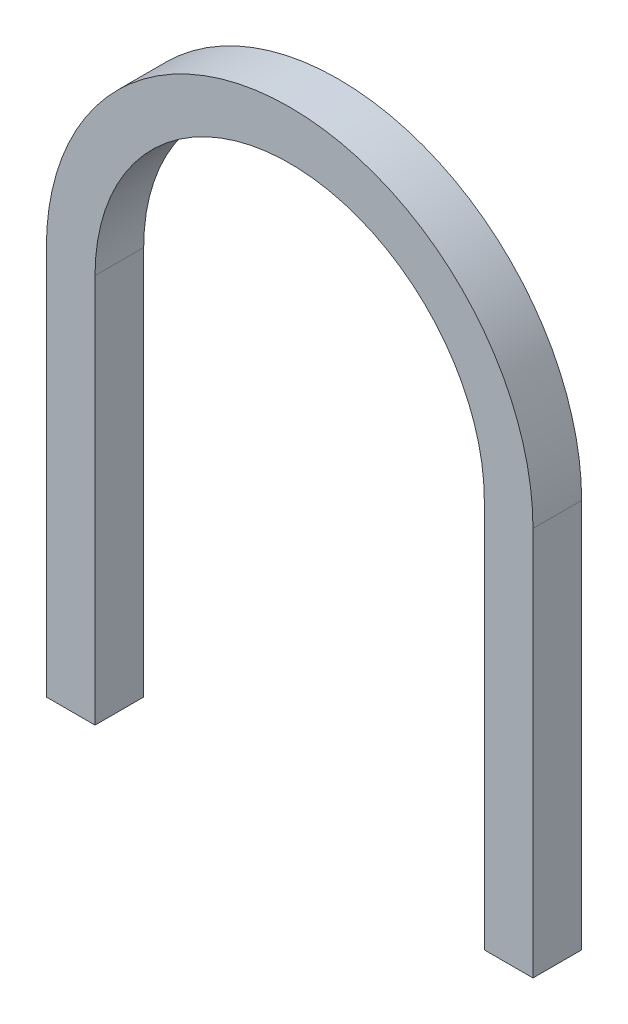
from build123d import *

# Parameters (mm, degrees)
BOSS_EXTRU_1_DEPTH = 5


with BuildPart() as part:
    # Esquisse1 → Boss.-Extru.1 (new body)
    with BuildSketch(Plane.XY):
        with BuildLine():
            Line((-20, 0), (-20, 40))
            ThreePointArc((-20, 40), (0, 60), (20, 40))
            Line((20, 40), (20, 0))
            Line((20, 0), (25, 0))
            Line((25, 0), (25, 40))
            ThreePointArc((25, 40), (0, 65), (-25, 40))
            Line((-25, 40), (-25, 0))
            Line((-25, 0), (-20, 0))
        make_face()
    extrude(amount=BOSS_EXTRU_1_DEPTH)


solid = part.part
